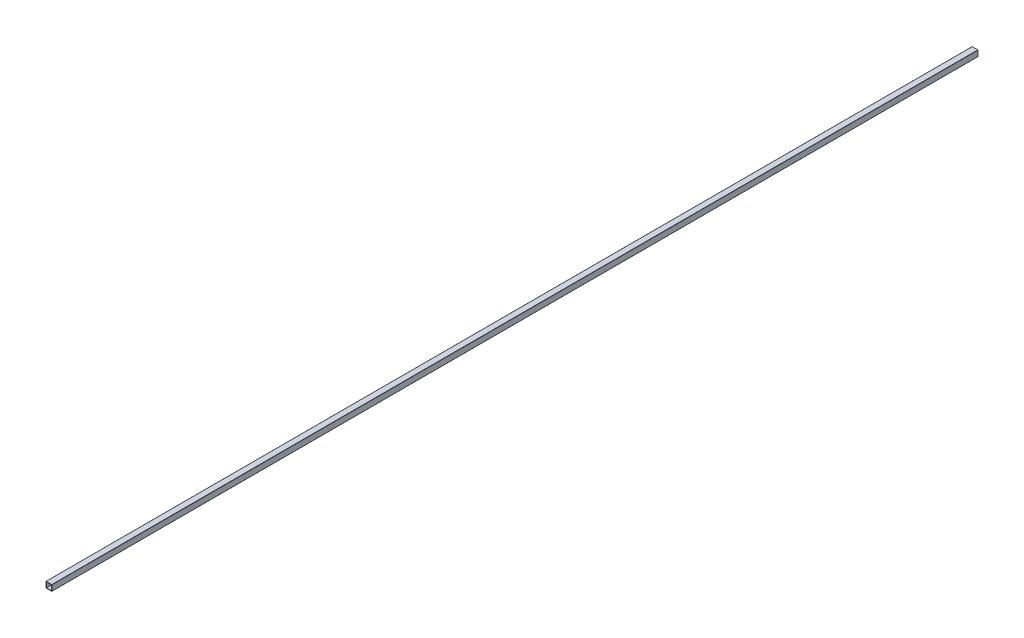
from build123d import *

# Parameters (mm, degrees)
CROQUIS1_W              = 32.78
CROQUIS1_H              = 32.78
SALIENTE_EXTRUIR1_DEPTH = 6000


with BuildPart() as part:
    # Croquis1 → Saliente-Extruir1 (new body)
    with BuildSketch(Plane.XY):
        with BuildLine():
            Line((-18.05, -19.05), (18.05, -19.05))
            ThreePointArc((18.05, -19.05), (18.757106781, -18.757106781), (19.05, -18.05))
            Line((19.05, -18.05), (19.05, 18.05))
            ThreePointArc((19.05, 18.05), (18.757106781, 18.757106781), (18.05, 19.05))
            Line((18.05, 19.05), (-18.05, 19.05))
            ThreePointArc((-18.05, 19.05), (-18.757106781, 18.757106781), (-19.05, 18.05))
            Line((-19.05, 18.05), (-19.05, -18.05))
            ThreePointArc((-19.05, -18.05), (-18.757106781, -18.757106781), (-18.05, -19.05))
        make_face()
        Rectangle(CROQUIS1_W, CROQUIS1_H, mode=Mode.SUBTRACT)
    extrude(amount=SALIENTE_EXTRUIR1_DEPTH)


solid = part.part
